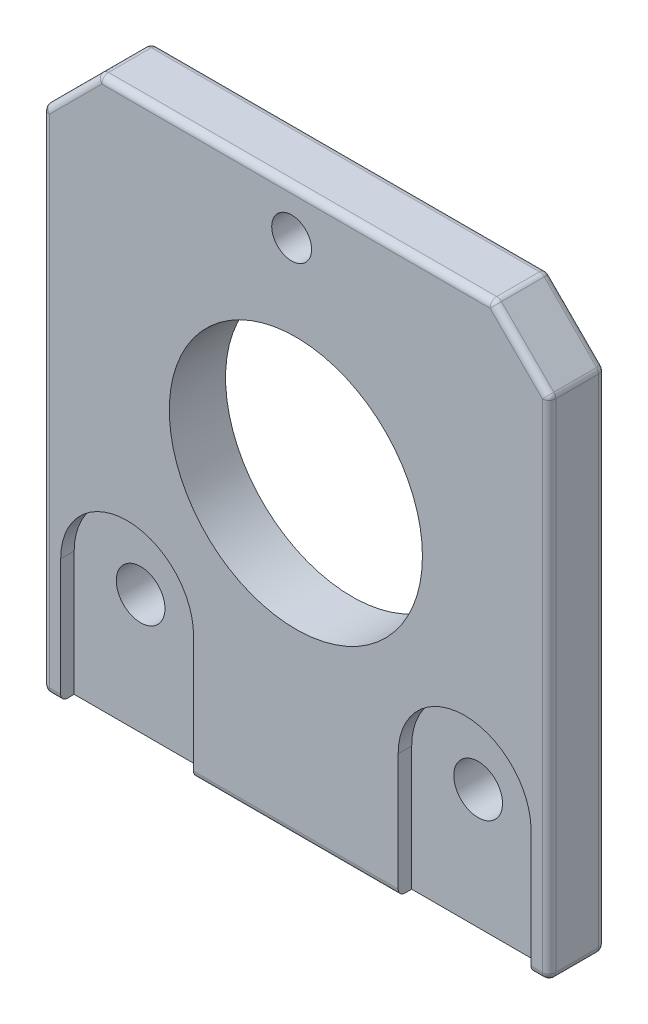
from build123d import *

# Parameters (mm, degrees)
SKETCH2_W            = 57.15
SKETCH2_H            = 6.35
BOSS_EXTRUDE1_DEPTH  = 63.5
SKETCH3_R            = 14.2875
CUT_EXTRUDE1_DEPTH   = 70.922121857
CHAMFER1_SIZE        = 6.35
M4_CLEARANCE_HOLE1_D = 4.5
M5_CLEARANCE_HOLE1_D = 5.5
FILLET1_R            = 0.762
CUT_EXTRUDE4_DEPTH   = 1.524


with BuildPart() as part:
    # Sketch2 → Boss-Extrude1 (new body)
    with BuildSketch(Plane(origin=(0, 0, 0), x_dir=(1, 0, 0), z_dir=(0, 1, 0))):
        Rectangle(SKETCH2_W, SKETCH2_H)
    extrude(amount=-BOSS_EXTRUDE1_DEPTH)

    # Sketch3 → Cut-Extrude1 (cut, through all)
    with BuildSketch(Plane.XY.offset(3.175)):
        with Locations((0, -28.8150046)):
            Circle(SKETCH3_R)
    extrude(amount=-CUT_EXTRUDE1_DEPTH, mode=Mode.SUBTRACT)

    # Chamfer1
    chamfer1_edges = [part.edges().sort_by_distance(p)[0] for p in [
        (28.575, 0, 0),
        (-28.575, 0, 0),
    ]]
    chamfer(chamfer1_edges, length=CHAMFER1_SIZE)

    # M4 Clearance Hole1 (through all)
    with Locations(Plane(origin=(0, 0, -3.175), x_dir=(-1, 0, 0), z_dir=(0, 0, -1))):
        with Locations((0.479594109, -5.08436305)):
            Hole(M4_CLEARANCE_HOLE1_D / 2)

    # M5 Clearance Hole1 (through all)
    with Locations(Plane.XY.offset(3.175)):
        with Locations((-19.05, -50.000003124), (19.05, -50.000003124)):
            Hole(M5_CLEARANCE_HOLE1_D / 2)

    # Fillet1
    fillet1_edges = [part.edges().sort_by_distance(p)[0] for p in [
        (28.575, -63.5, 0),
        (0, -63.5, -3.175),
        (0, 0, 3.175),
        (0, 0, -3.175),
        (22.225, 0, 0),
        (-22.225, 0, 0),
        (25.4, -3.175, 3.175),
        (-25.4, -3.175, 3.175),
        (-28.575, -6.35, 0),
        (25.4, -3.175, -3.175),
        (-25.4, -3.175, -3.175),
        (28.575, -6.35, 0),
        (-28.575, -63.5, 0),
        (-28.575, -34.925, -3.175),
        (28.575, -34.925, -3.175),
        (28.575, -34.925, 3.175),
        (-28.575, -34.925, 3.175),
        (0, -63.5, 3.175),
    ]]
    fillet(fillet1_edges, radius=FILLET1_R)

    # Sketch8 → Cut-Extrude4 (cut)
    with BuildSketch(Plane.XY.offset(3.175)):
        with BuildLine():
            Line((11.55, -63.5), (11.55, -49.5))
            ThreePointArc((11.55, -49.5), (19.05, -42), (26.55, -49.5))
            Line((26.55, -49.5), (26.55, -63.5))
            Line((26.55, -63.5), (11.55, -63.5))
        make_face()
    cut_extrude4 = extrude(amount=-CUT_EXTRUDE4_DEPTH, mode=Mode.SUBTRACT)

    # Mirror1: Cut-Extrude4 across plane
    add(cut_extrude4.mirror(Plane(origin=(0, 0, 0), x_dir=(0, 0, 1), z_dir=(1, 0, 0))), mode=Mode.SUBTRACT)


solid = part.part
